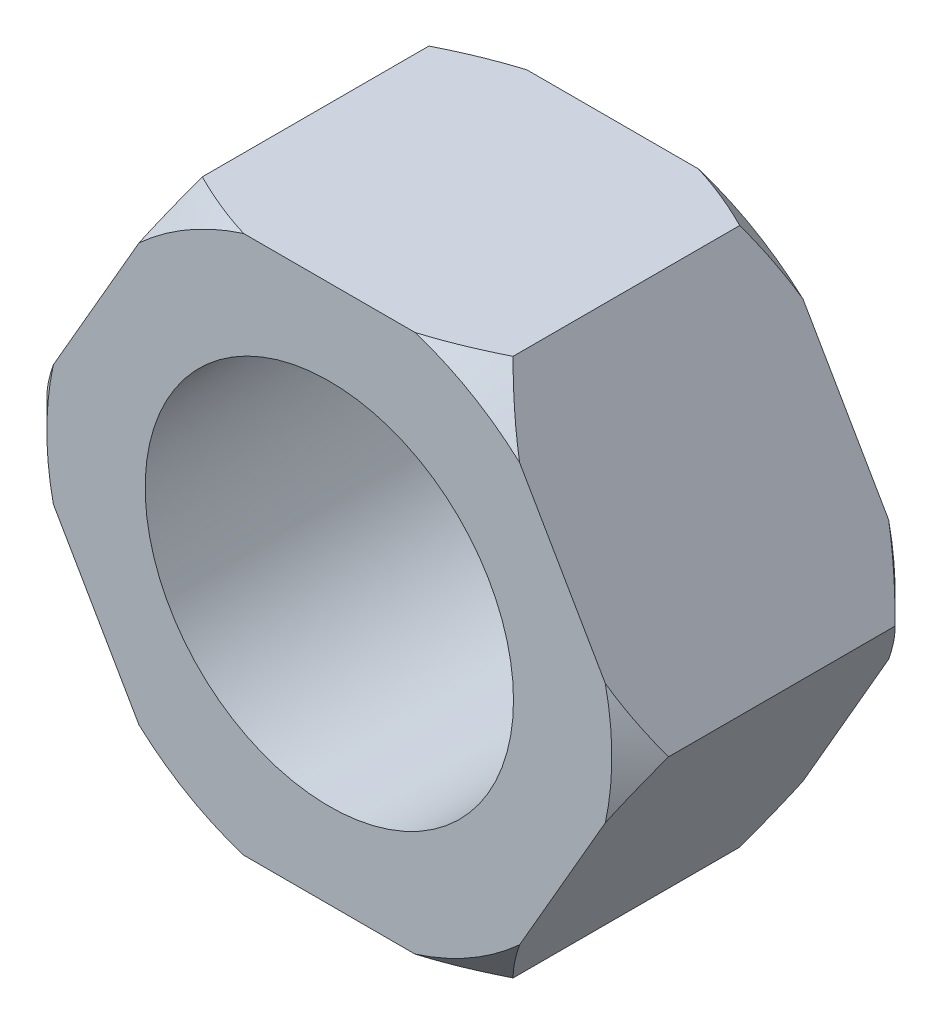
from build123d import *

# Parameters (mm, degrees)
SKETCH1_R           = 6.5
BOSS_EXTRUDE1_DEPTH = 10


with BuildPart() as part:
    # Sketch1 → Boss-Extrude1 (new body)
    with BuildSketch(Plane.XY):
        Polygon((10.969655115, 0), (5.484827557, 9.5), (-5.484827557, 9.5), (-10.969655115, 0), (-5.484827557, -9.5), (5.484827557, -9.5), align=None)
        Circle(SKETCH1_R, mode=Mode.SUBTRACT)
    extrude(amount=BOSS_EXTRUDE1_DEPTH)

    # Sketch2 → Cut-Revolve3 (revolve, cut)
    with BuildSketch(Plane(origin=(0, 0, 0), x_dir=(0, 0, -1), z_dir=(0, 1, 0))):
        Polygon((-9, 10.969655115), (-10, 9.969655115), (-10, 10.969655115), align=None)
        Polygon((-1, 10.969655115), (0, 9.969655115), (0, 10.969655115), align=None)
    revolve(axis=Axis((0, 0, 0), (0, 0, 1)), mode=Mode.SUBTRACT)


solid = part.part
